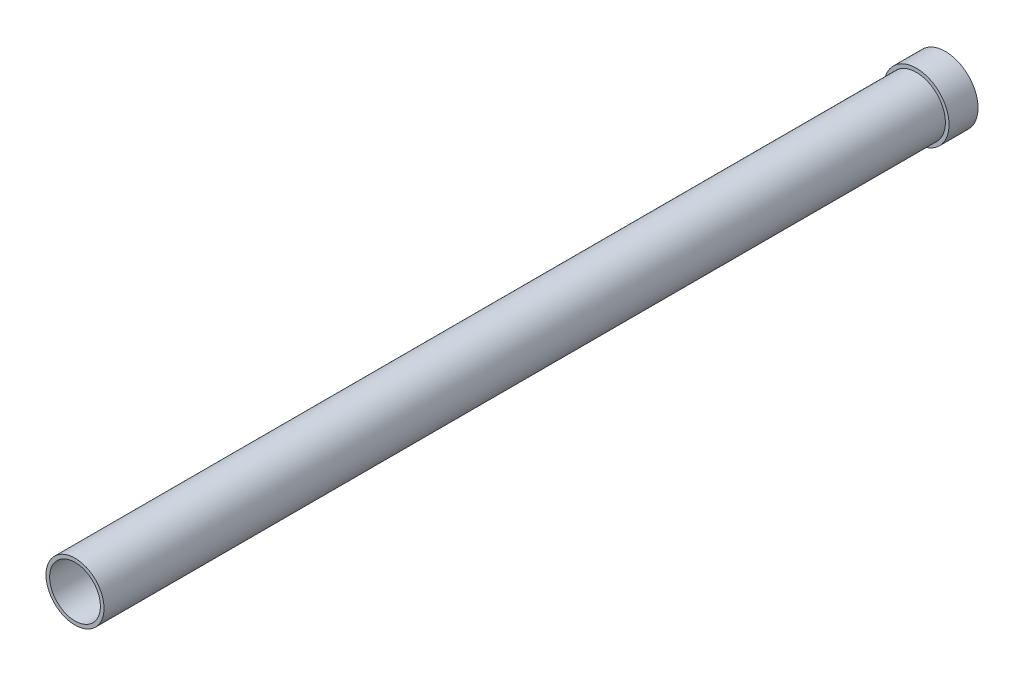
from build123d import *

# Parameters (mm, degrees)
SKETCH1_R           = 2.54
SKETCH1_R_2         = 2.2225
BOSS_EXTRUDE1_DEPTH = 76.2
SKETCH2_R           = 2.8575
SKETCH2_R_2         = 2.54
BOSS_EXTRUDE2_DEPTH = 2.54


with BuildPart() as part:
    # Sketch1 → Boss-Extrude1 (new body)
    with BuildSketch(Plane.XY):
        with Locations(Location((0, 0, 0), (0, 0, 180))):
            Circle(SKETCH1_R)
        with Locations(Location((0, 0, 0), (0, 0, 180))):
            Circle(SKETCH1_R_2, mode=Mode.SUBTRACT)
    extrude(amount=BOSS_EXTRUDE1_DEPTH)

    # Sketch2 → Boss-Extrude2 (add)
    with BuildSketch(Plane(origin=(0, 0, 0), x_dir=(-1, 0, 0), z_dir=(0, 0, -1))):
        Circle(SKETCH2_R)
        Circle(SKETCH2_R_2, mode=Mode.SUBTRACT)
    extrude(amount=-BOSS_EXTRUDE2_DEPTH)


solid = part.part
